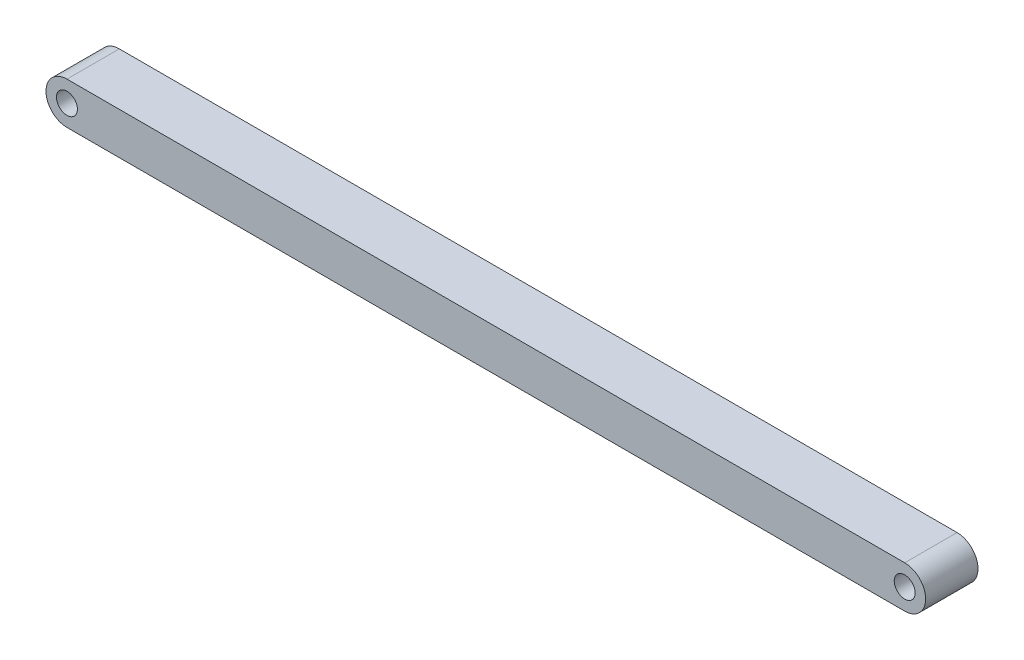
from build123d import *

# Parameters (mm, degrees)
SKETCH_2_R      = 2
SKETCH_2_R_2    = 1
EXTRUDE_1_DEPTH = 5


with BuildPart() as part:
    # 草图2 → 凸台-拉伸1 (new body)
    # profile 1 of 3: a face of its own
    with BuildSketch(Plane.XY):
        Circle(SKETCH_2_R)
        Circle(SKETCH_2_R_2, mode=Mode.SUBTRACT)
    # profile 2 of 3: a face of its own
    with BuildSketch(Plane.XY):
        with BuildLine():
            ThreePointArc((2, 0), (1.414213562, -1.414213562), (0, -2))
            Line((0, -2), (80, -2))
            ThreePointArc((80, -2), (78, 0), (80, 2))
            Line((80, 2), (0, 2))
            ThreePointArc((0, 2), (1.414213562, 1.414213562), (2, 0))
        make_face()
    # profile 3 of 3: a face of its own
    with BuildSketch(Plane.XY):
        with Locations((80, 0)):
            Circle(SKETCH_2_R)
        with Locations((80, 0)):
            Circle(SKETCH_2_R_2, mode=Mode.SUBTRACT)
    extrude(amount=EXTRUDE_1_DEPTH)


solid = part.part
